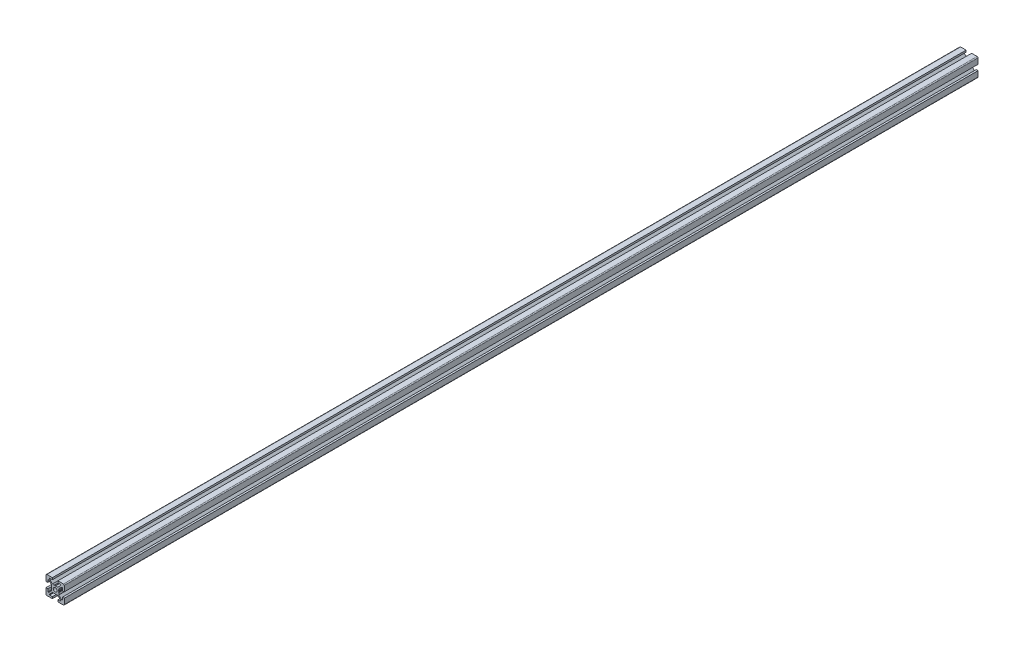
from build123d import *

# Parameters (mm, degrees)
SKETCH1_R           = 2.1
BOSS_EXTRUDE1_DEPTH = 1000


with BuildPart() as part:
    # Sketch1 → Boss-Extrude1 (new body)
    with BuildSketch(Plane(origin=(0, 0, -2000), x_dir=(-1, 0, 0), z_dir=(0, 0, -1))):
        with BuildLine():
            Line((10, -3), (8, -3))
            Line((8, -3), (8, -6))
            Line((8, -6), (7.060660172, -6))
            Line((7.060660172, -6), (4, -2.939339828))
            Line((4, -2.939339828), (4, -2.5))
            Line((4, -2.5), (3.750976592, -1.218885629))
            Line((3.750976592, -1.218885629), (3.933012702, -0.903589838))
            ThreePointArc((3.933012702, -0.903589838), (4, -0.653589838), (3.933012702, -0.403589838))
            Line((3.933012702, -0.403589838), (3.7, 0))
            Line((3.7, 0), (3.933012702, 0.403589838))
            ThreePointArc((3.933012702, 0.403589838), (3.982962913, 0.524180316), (4, 0.653589838))
            Line((4, 0.653589838), (4, 2.939339828))
            Line((4, 2.939339828), (7.060660172, 6))
            Line((7.060660172, 6), (8, 6))
            Line((8, 6), (8, 3))
            Line((8, 3), (10, 3))
            Line((10, 3), (10, 9))
            ThreePointArc((10, 9), (9.707106781, 9.707106781), (9, 10))
            Line((9, 10), (3, 10))
            Line((3, 10), (3, 8))
            Line((3, 8), (6, 8))
            Line((6, 8), (6, 7.060660172))
            Line((6, 7.060660172), (2.939339828, 4))
            Line((2.939339828, 4), (2.5, 4))
            Line((2.5, 4), (1.218885629, 3.750976592))
            Line((1.218885629, 3.750976592), (0.903589838, 3.933012702))
            ThreePointArc((0.903589838, 3.933012702), (0.653589838, 4), (0.403589838, 3.933012702))
            Line((0.403589838, 3.933012702), (0, 3.7))
            Line((0, 3.7), (-0.403589838, 3.933012702))
            ThreePointArc((-0.403589838, 3.933012702), (-0.524180316, 3.982962913), (-0.653589838, 4))
            Line((-0.653589838, 4), (-2.939339828, 4))
            Line((-2.939339828, 4), (-6, 7.060660172))
            Line((-6, 7.060660172), (-6, 8))
            Line((-6, 8), (-3, 8))
            Line((-3, 8), (-3, 10))
            Line((-3, 10), (-9, 10))
            ThreePointArc((-9, 10), (-9.707106781, 9.707106781), (-10, 9))
            Line((-10, 9), (-10, 3))
            Line((-10, 3), (-8, 3))
            Line((-8, 3), (-8, 6))
            Line((-8, 6), (-7.060660172, 6))
            Line((-7.060660172, 6), (-4, 2.939339828))
            Line((-4, 2.939339828), (-4, 2.5))
            Line((-4, 2.5), (-3.750976592, 1.218885629))
            Line((-3.750976592, 1.218885629), (-3.933012702, 0.903589838))
            ThreePointArc((-3.933012702, 0.903589838), (-4, 0.653589838), (-3.933012702, 0.403589838))
            Line((-3.933012702, 0.403589838), (-3.7, 0))
            Line((-3.7, 0), (-3.933012702, -0.403589838))
            ThreePointArc((-3.933012702, -0.403589838), (-3.982962913, -0.524180316), (-4, -0.653589838))
            Line((-4, -0.653589838), (-4, -2.939339828))
            Line((-4, -2.939339828), (-7.060660172, -6))
            Line((-7.060660172, -6), (-8, -6))
            Line((-8, -6), (-8, -3))
            Line((-8, -3), (-10, -3))
            Line((-10, -3), (-10, -9))
            ThreePointArc((-10, -9), (-9.707106781, -9.707106781), (-9, -10))
            Line((-9, -10), (-3, -10))
            Line((-3, -10), (-3, -8))
            Line((-3, -8), (-6, -8))
            Line((-6, -8), (-6, -7.060660172))
            Line((-6, -7.060660172), (-2.939339828, -4))
            Line((-2.939339828, -4), (-2.5, -4))
            Line((-2.5, -4), (-1.218885629, -3.750976592))
            Line((-1.218885629, -3.750976592), (-0.903589838, -3.933012702))
            ThreePointArc((-0.903589838, -3.933012702), (-0.653589838, -4), (-0.403589838, -3.933012702))
            Line((-0.403589838, -3.933012702), (0, -3.7))
            Line((0, -3.7), (0.403589838, -3.933012702))
            ThreePointArc((0.403589838, -3.933012702), (0.524180316, -3.982962913), (0.653589838, -4))
            Line((0.653589838, -4), (2.939339828, -4))
            Line((2.939339828, -4), (6, -7.060660172))
            Line((6, -7.060660172), (6, -8))
            Line((6, -8), (3, -8))
            Line((3, -8), (3, -10))
            Line((3, -10), (9, -10))
            ThreePointArc((9, -10), (9.707106781, -9.707106781), (10, -9))
            Line((10, -9), (10, -3))
        make_face()
        with Locations(Location((0, 0, 0), (0, 0, 180))):
            Circle(SKETCH1_R, mode=Mode.SUBTRACT)
    extrude(amount=-BOSS_EXTRUDE1_DEPTH)


solid = part.part
